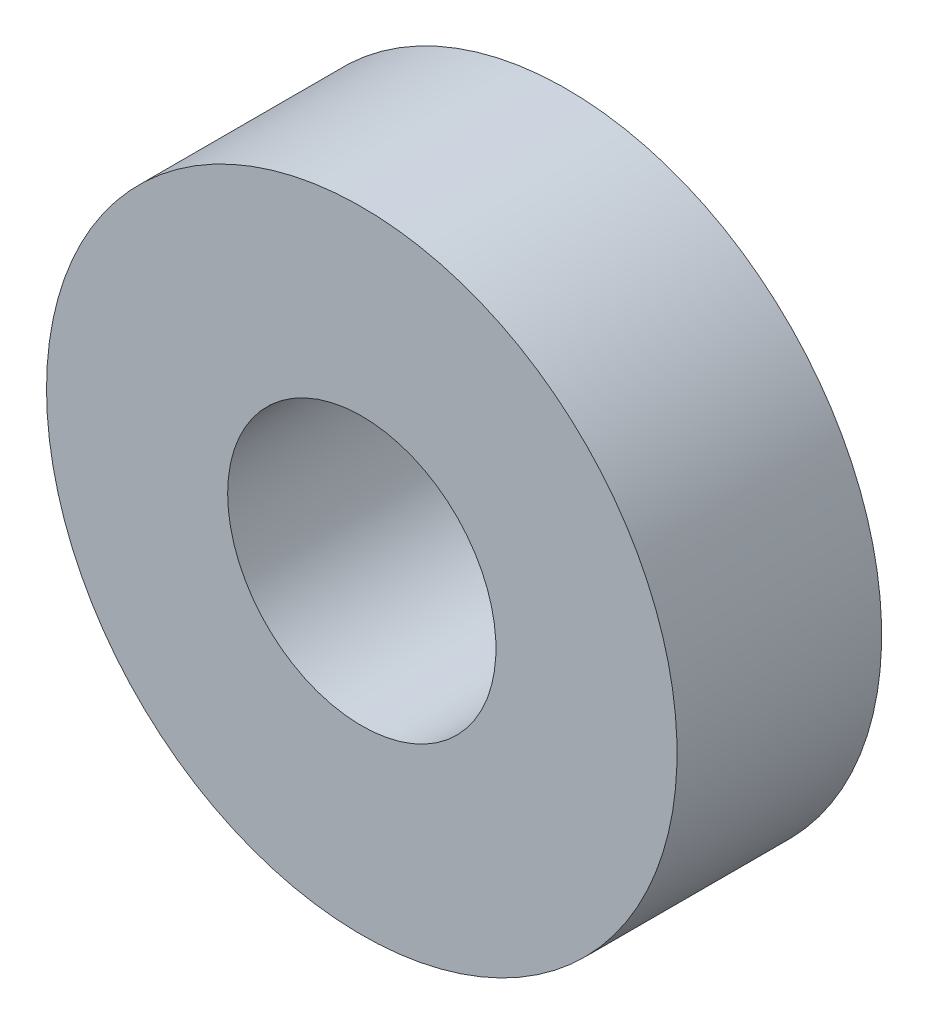
from build123d import *

# Parameters (mm, degrees)
SKETCH1_R           = 23.5
SKETCH1_R_2         = 10
BOSS_EXTRUDE1_DEPTH = 15.25


with BuildPart() as part:
    # Sketch1 → Boss-Extrude1 (new body)
    with BuildSketch(Plane.XY):
        with Locations(Location((0, 0, 0), (0, 0, 180))):
            Circle(SKETCH1_R)
        with Locations(Location((0, 0, 0), (0, 0, 180))):
            Circle(SKETCH1_R_2, mode=Mode.SUBTRACT)
    extrude(amount=BOSS_EXTRUDE1_DEPTH)


solid = part.part
